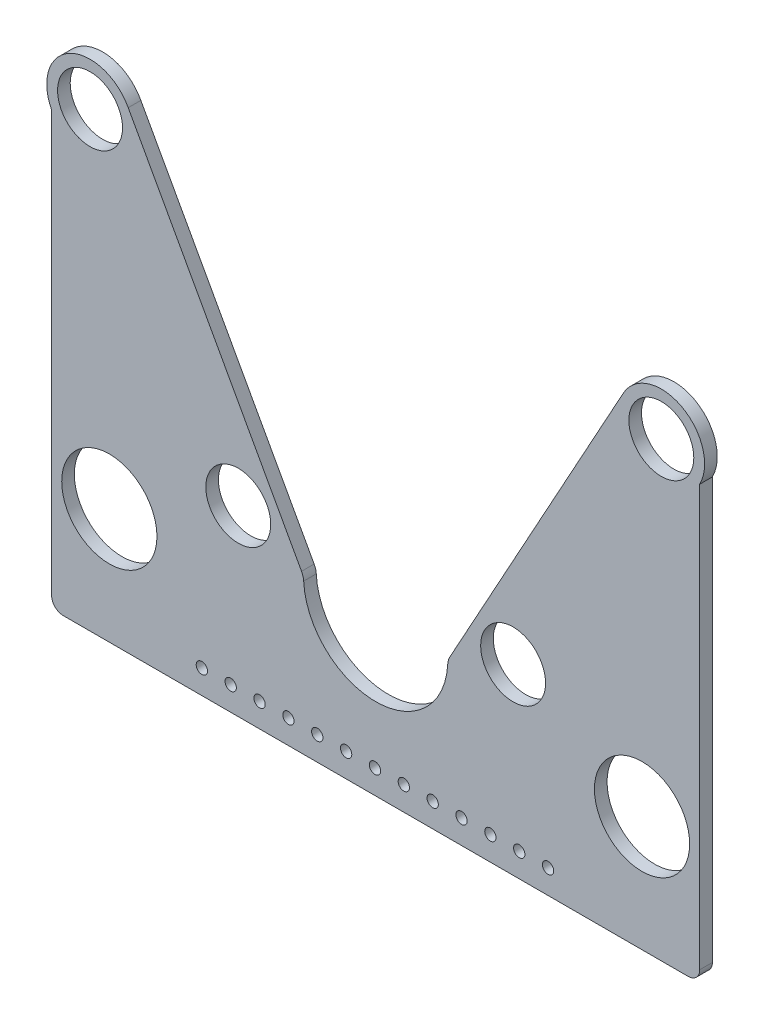
from build123d import *
from build123d.topology import SkipClean

# Parameters (mm, degrees)
SKETCH2_R           = 14.2875
SKETCH2_R_2         = 2.4892
SKETCH2_R_3         = 20.955
BOSS_EXTRUDE1_DEPTH = 3.175
FILLET2_R           = 7.62
BOSS_EXTRUDE2_START = 2.38125
SKETCH4_R           = 2.4892
SKETCH4_R_2         = 14.2875
SKETCH4_R_3         = 20.955
BOSS_EXTRUDE2_DEPTH = 2.38125


with BuildPart() as part:
    # Sketch2 → Boss-Extrude1 (new body)
    with BuildSketch(Plane.XY):
        with BuildLine():
            Line((142.632381685, 122.462939957), (142.632381685, -29.937060043))
            Line((142.632381685, -29.937060043), (142.632381685, -56.741928905))
            Line((142.632381685, -56.741928905), (142.632381685, -62.620500771))
            ThreePointArc((142.632381685, -62.620500771), (141.144484133, -66.21260322), (137.552381685, -67.700500771))
            Line((137.552381685, -67.700500771), (-137.552381685, -67.700500771))
            ThreePointArc((-137.552381685, -67.700500771), (-141.144484133, -66.21260322), (-142.632381685, -62.620500771))
            Line((-142.632381685, -62.620500771), (-142.632381685, -56.741928905))
            Line((-142.632381685, -56.741928905), (-142.632381685, -29.937060043))
            Line((-142.632381685, -29.937060043), (-142.632381685, 122.462939957))
            ThreePointArc((-142.632381685, 122.462939957), (-134.600001748, 148.101160684), (-108.918256202, 140.209048469))
            Line((-108.918256202, 140.209048469), (-31.75, 0))
            ThreePointArc((-31.75, 0), (0, -31.75), (31.75, 0))
            Line((31.75, 0), (108.918256202, 140.209048469))
            ThreePointArc((108.918256202, 140.209048469), (134.600001748, 148.101160684), (142.632381685, 122.462939957))
        make_face()
        with Locations((-60.484532313, 12.7)):
            Circle(SKETCH2_R, mode=Mode.SUBTRACT)
        with Locations((-125.726814921, 131.243846084)):
            Circle(SKETCH2_R, mode=Mode.SUBTRACT)
        with Locations((125.726814921, 131.243846084)):
            Circle(SKETCH2_R, mode=Mode.SUBTRACT)
        with Locations((60.484532313, 12.7)):
            Circle(SKETCH2_R, mode=Mode.SUBTRACT)
        with Locations((-76.5175, -57.15)):
            Circle(SKETCH2_R_2, mode=Mode.SUBTRACT)
        with Locations((-63.8175, -57.15)):
            Circle(SKETCH2_R_2, mode=Mode.SUBTRACT)
        with Locations((-51.1175, -57.15)):
            Circle(SKETCH2_R_2, mode=Mode.SUBTRACT)
        with Locations((-38.4175, -57.15)):
            Circle(SKETCH2_R_2, mode=Mode.SUBTRACT)
        with Locations((-25.7175, -57.15)):
            Circle(SKETCH2_R_2, mode=Mode.SUBTRACT)
        with Locations((-13.0175, -57.15)):
            Circle(SKETCH2_R_2, mode=Mode.SUBTRACT)
        with Locations((-0.3175, -57.15)):
            Circle(SKETCH2_R_2, mode=Mode.SUBTRACT)
        with Locations((12.3825, -57.15)):
            Circle(SKETCH2_R_2, mode=Mode.SUBTRACT)
        with Locations((25.0825, -57.15)):
            Circle(SKETCH2_R_2, mode=Mode.SUBTRACT)
        with Locations((37.7825, -57.15)):
            Circle(SKETCH2_R_2, mode=Mode.SUBTRACT)
        with Locations((50.4825, -57.15)):
            Circle(SKETCH2_R_2, mode=Mode.SUBTRACT)
        with Locations((63.1825, -57.15)):
            Circle(SKETCH2_R_2, mode=Mode.SUBTRACT)
        with Locations((75.8825, -57.15)):
            Circle(SKETCH2_R_2, mode=Mode.SUBTRACT)
        with Locations((-117.232381685, -16.900500771)):
            Circle(SKETCH2_R_3, mode=Mode.SUBTRACT)
        with Locations((117.232381685, -16.900500771)):
            Circle(SKETCH2_R_3, mode=Mode.SUBTRACT)
    extrude(amount=BOSS_EXTRUDE1_DEPTH)

    # Fillet2
    fillet2_edges = [part.edges().sort_by_distance(p)[0] for p in [
        (-31.75, 0, 1.5875),
        (31.75, 0, 1.5875),
    ]]
    fillet(fillet2_edges, radius=FILLET2_R)

    # Sketch4 → Boss-Extrude2 (add)
    with SkipClean():  # the faces are left unmerged after this step: merging them gives an invalid solid
        with BuildSketch(Plane(origin=(0, 0, 0), x_dir=(-1, 0, 0), z_dir=(0, 0, -1)).offset(BOSS_EXTRUDE2_START)):
            with BuildLine():
                Line((-32.640582486, 1.618122906), (-108.918256202, 140.209048469))
                ThreePointArc((-108.918256202, 140.209048469), (-134.600001748, 148.101160684), (-142.632381685, 122.462939957))
                Line((-142.632381685, 122.462939957), (-142.632381685, -62.620500771))
                ThreePointArc((-142.632381685, -62.620500771), (-141.144484133, -66.21260322), (-137.552381685, -67.700500771))
                Line((-137.552381685, -67.700500771), (137.552381685, -67.700500771))
                ThreePointArc((137.552381685, -67.700500771), (141.144484133, -66.21260322), (142.632381685, -62.620500771))
                Line((142.632381685, -62.620500771), (142.632381685, 122.462939957))
                ThreePointArc((142.632381685, 122.462939957), (134.600001748, 148.101160684), (108.918256202, 140.209048469))
                Line((108.918256202, 140.209048469), (32.640582486, 1.618122906))
                ThreePointArc((32.640582486, 1.618122906), (31.988191315, 0.032870886), (31.706674385, -1.65810115))
                ThreePointArc((31.706674385, -1.65810115), (0, -31.75), (-31.706674385, -1.65810115))
                ThreePointArc((-31.706674385, -1.65810115), (-31.988191315, 0.032870886), (-32.640582486, 1.618122906))
            make_face()
            with Locations((-75.8825, -57.15)):
                Circle(SKETCH4_R, mode=Mode.SUBTRACT)
            with Locations((-63.1825, -57.15)):
                Circle(SKETCH4_R, mode=Mode.SUBTRACT)
            with Locations((-50.4825, -57.15)):
                Circle(SKETCH4_R, mode=Mode.SUBTRACT)
            with Locations((-37.7825, -57.15)):
                Circle(SKETCH4_R, mode=Mode.SUBTRACT)
            with Locations((-25.0825, -57.15)):
                Circle(SKETCH4_R, mode=Mode.SUBTRACT)
            with Locations((-12.3825, -57.15)):
                Circle(SKETCH4_R, mode=Mode.SUBTRACT)
            with Locations((0.3175, -57.15)):
                Circle(SKETCH4_R, mode=Mode.SUBTRACT)
            with Locations((13.0175, -57.15)):
                Circle(SKETCH4_R, mode=Mode.SUBTRACT)
            with Locations((25.7175, -57.15)):
                Circle(SKETCH4_R, mode=Mode.SUBTRACT)
            with Locations((38.4175, -57.15)):
                Circle(SKETCH4_R, mode=Mode.SUBTRACT)
            with Locations((51.1175, -57.15)):
                Circle(SKETCH4_R, mode=Mode.SUBTRACT)
            with Locations((63.8175, -57.15)):
                Circle(SKETCH4_R, mode=Mode.SUBTRACT)
            with Locations((76.5175, -57.15)):
                Circle(SKETCH4_R, mode=Mode.SUBTRACT)
            with Locations((125.726814921, 131.243846084)):
                Circle(SKETCH4_R_2, mode=Mode.SUBTRACT)
            with Locations((117.232381685, -16.900500771)):
                Circle(SKETCH4_R_3, mode=Mode.SUBTRACT)
            with Locations((60.484532313, 12.7)):
                Circle(SKETCH4_R_2, mode=Mode.SUBTRACT)
            with Locations((-60.484532313, 12.7)):
                Circle(SKETCH4_R_2, mode=Mode.SUBTRACT)
            with Locations((-117.232381685, -16.900500771)):
                Circle(SKETCH4_R_3, mode=Mode.SUBTRACT)
            with Locations((-125.726814921, 131.243846084)):
                Circle(SKETCH4_R_2, mode=Mode.SUBTRACT)
        extrude(amount=-BOSS_EXTRUDE2_DEPTH)


solid = part.part
